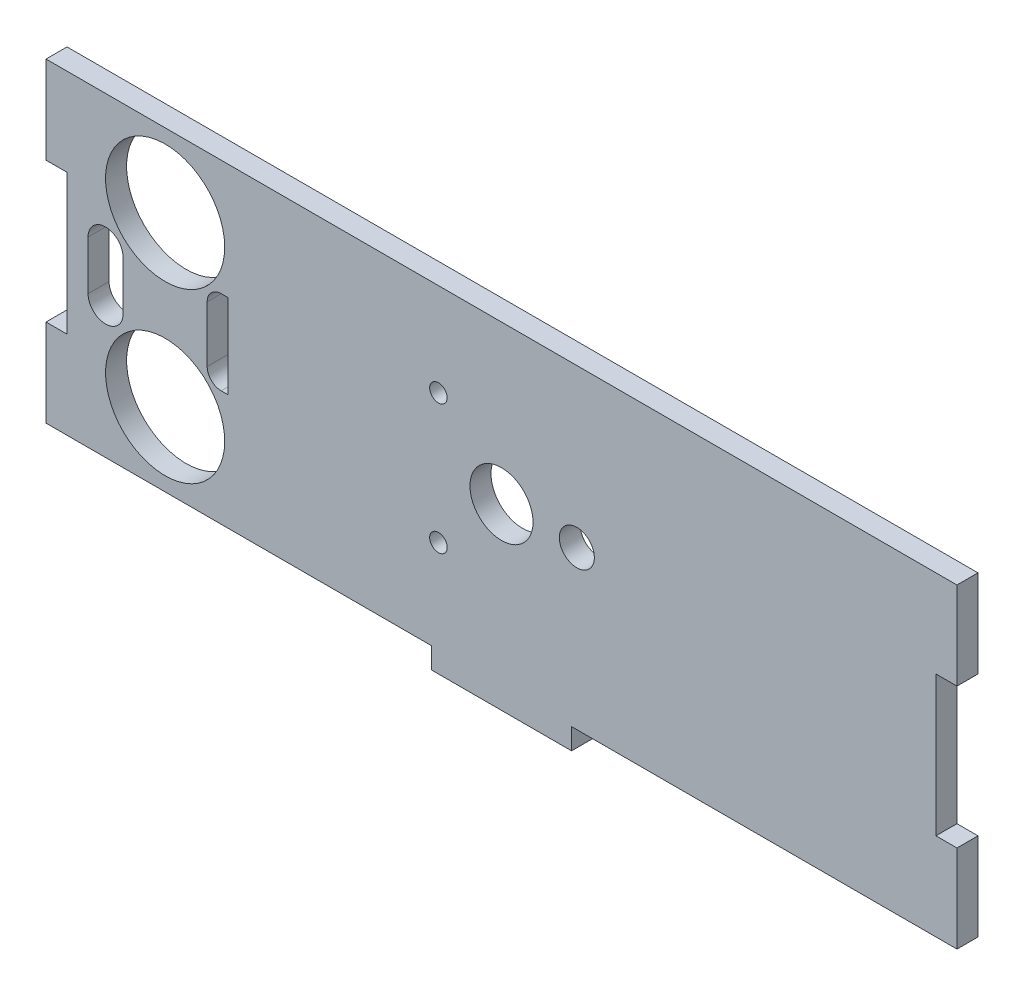
from build123d import *

# Parameters (mm, degrees)
SKETCH1_R           = 8.5
SKETCH1_R_2         = 4.5
SKETCH1_R_3         = 2.5
SKETCH1_R_4         = 1.25
BOSS_EXTRUDE1_DEPTH = 3


with BuildPart() as part:
    # Sketch1 → Boss-Extrude1 (new body)
    with BuildSketch(Plane.XY):
        Polygon((-10, -22.5), (-65, -22.5), (-65, -10), (-62, -10), (-62, 10), (-65, 10), (-65, 22.5), (65, 22.5), (65, 10), (62, 10), (62, -10), (65, -10), (65, -22.5), (10, -22.5), (10, -25.5), (-10, -25.5), align=None)
        with Locations((-48, 12)):
            Circle(SKETCH1_R, mode=Mode.SUBTRACT)
        with Locations((-48, -12)):
            Circle(SKETCH1_R, mode=Mode.SUBTRACT)
        Circle(SKETCH1_R_2, mode=Mode.SUBTRACT)
        with Locations((10.75, 0)):
            Circle(SKETCH1_R_3, mode=Mode.SUBTRACT)
        with Locations((-9, 9.25)):
            Circle(SKETCH1_R_4, mode=Mode.SUBTRACT)
        with Locations(Location((-9, -9.25, 0), (0, 0, 180))):
            Circle(SKETCH1_R_4, mode=Mode.SUBTRACT)
        with BuildLine():
            Line((-54, 3.5), (-54, -3.5))
            ThreePointArc((-54, -3.5), (-56.5, -6), (-59, -3.5))
            Line((-59, -3.5), (-59, 3.5))
            ThreePointArc((-59, 3.5), (-56.5, 6), (-54, 3.5))
        make_face(mode=Mode.SUBTRACT)
        with BuildLine():
            Line((-39, -6), (-40, -6))
            ThreePointArc((-40, -6), (-41.414213562, -5.414213562), (-42, -4))
            Line((-42, -4), (-42, 4))
            ThreePointArc((-42, 4), (-41.414213562, 5.414213562), (-40, 6))
            Line((-40, 6), (-39, 6))
            Line((-39, 6), (-39, -6))
        make_face(mode=Mode.SUBTRACT)
    extrude(amount=BOSS_EXTRUDE1_DEPTH)


solid = part.part
